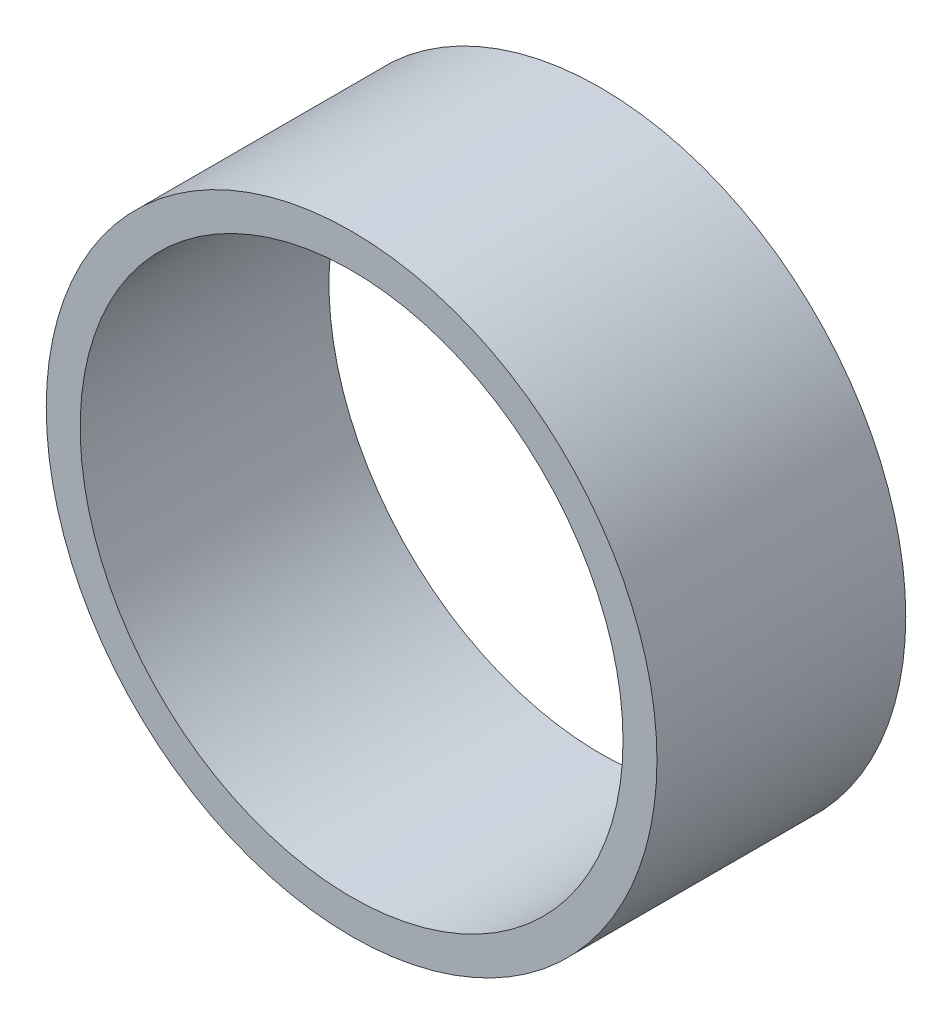
from build123d import *

# Parameters (mm, degrees)
SKETCH2_R           = 67.5
BOSS_EXTRUDE1_DEPTH = 27.5
SKETCH3_R           = 60
CUT_EXTRUDE1_DEPTH  = 111.170322683


with BuildPart() as part:
    # Sketch2 → Boss-Extrude1 (new, symmetric)
    with BuildSketch(Plane.XY):
        Circle(SKETCH2_R)
    extrude(amount=BOSS_EXTRUDE1_DEPTH, both=True)

    # Sketch3 → Cut-Extrude1 (cut, through all)
    with BuildSketch(Plane.XY.offset(27.5)):
        Circle(SKETCH3_R)
    extrude(amount=-CUT_EXTRUDE1_DEPTH, mode=Mode.SUBTRACT)


solid = part.part
